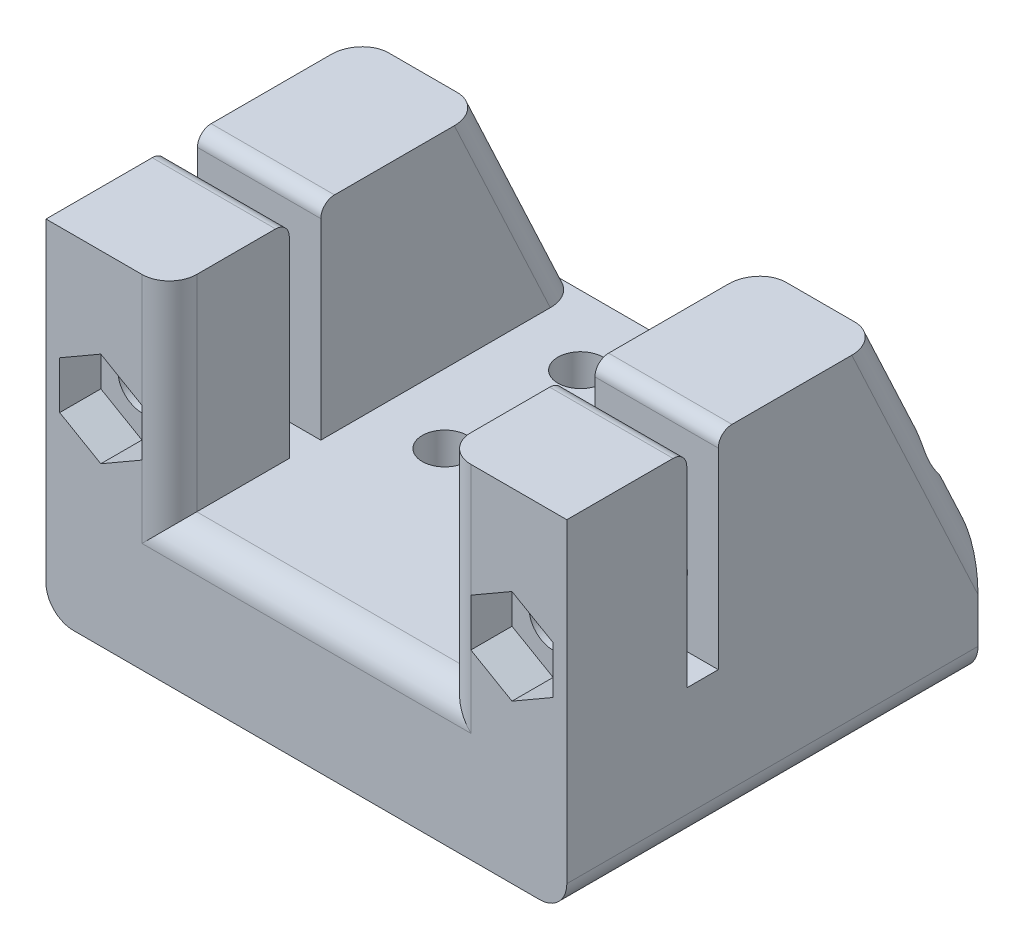
from build123d import *

# Parameters (mm, degrees)
SKETCH_1_W             = 38
SKETCH_1_H             = 30
SKETCH_1_R             = 1.65
EXTRUDE_694_DEPTH      = 25
SKETCH_3_W             = 20
SKETCH_3_H             = 30
CUT_EXTRUDE_926_DEPTH  = 15
SKETCH_4_W             = 2.3
SKETCH_4_H             = 15
CUT_EXTRUDE_1406_DEPTH = 55.488530903
FILLET_3_R             = 1
FILLET_4_R             = 2
SKETCH_6_R             = 1.75
CUT_EXTRUDE_2902_DEPTH = 55.488530903
SKETCH_7_R             = 3.5
CUT_EXTRUDE_3145_DEPTH = 10
CUT_EXTRUDE_3527_DEPTH = 3


with BuildPart() as part:
    # Эскиз1 → Extrude 694 (new body)
    with BuildSketch(Plane(origin=(0, 0, 0), x_dir=(1, 0, 0), z_dir=(0, 1, 0))):
        with Locations((19, 15)):
            Rectangle(SKETCH_1_W, SKETCH_1_H)
        with Locations(Location((14.050252532, 24.949747468, 0), (0, 0, 270))):
            Circle(SKETCH_1_R, mode=Mode.SUBTRACT)
        with Locations(Location((23.949747468, 24.949747468, 0), (0, 0, 270))):
            Circle(SKETCH_1_R, mode=Mode.SUBTRACT)
        with Locations(Location((23.949747468, 15.050252532, 0), (0, 0, 270))):
            Circle(SKETCH_1_R, mode=Mode.SUBTRACT)
        with Locations(Location((14.050252532, 15.050252532, 0), (0, 0, 270))):
            Circle(SKETCH_1_R, mode=Mode.SUBTRACT)
    extrude(amount=EXTRUDE_694_DEPTH)

    # Эскиз3 → Cut-Extrude 926 (cut)
    with BuildSketch(Plane(origin=(0, 25, 0), x_dir=(1, 0, 0), z_dir=(0, 1, 0))):
        with Locations((19, 15)):
            Rectangle(SKETCH_3_W, SKETCH_3_H)
    extrude(amount=-CUT_EXTRUDE_926_DEPTH, mode=Mode.SUBTRACT)

    # Эскиз4 → Cut-Extrude 1406 (cut, through all)
    with BuildSketch(Plane.ZY):
        Polygon((-30, 10), (-23, 25), (-30, 25), align=None)
        with Locations((-9.900252532, 17.5)):
            Rectangle(SKETCH_4_W, SKETCH_4_H)
    extrude(amount=-CUT_EXTRUDE_1406_DEPTH, mode=Mode.SUBTRACT)

    # Скругление3
    fillet_3_edges = [part.edges().sort_by_distance(p)[0] for p in [
        (4.5, 25, -11.050252532),
        (33.5, 25, -11.050252532),
        (4.5, 25, -8.750252532),
        (33.5, 25, -8.750252532),
    ]]
    fillet(fillet_3_edges, radius=FILLET_3_R)

    # Скругление4
    fillet_4_edges = [part.edges().sort_by_distance(p)[0] for p in [
        (9, 17.5, 0),
        (19, 10, 0),
        (29, 17.5, 0),
        (38, 0, -15),
        (0, 0, -15),
        (9, 17.5, -26.5),
        (29, 17.5, -26.5),
        (38, 17.5, -26.5),
        (0, 17.5, -26.5),
    ]]
    fillet(fillet_4_edges, radius=FILLET_4_R)

    # Эскиз6 → Cut-Extrude 2902 (cut, through all)
    with BuildSketch(Plane(origin=(0, 0, -30), x_dir=(-1, 0, 0), z_dir=(0, 0, -1))):
        with Locations((-34, 15)):
            Circle(SKETCH_6_R)
        with Locations((-4, 15)):
            Circle(SKETCH_6_R)
    extrude(amount=-CUT_EXTRUDE_2902_DEPTH, mode=Mode.SUBTRACT)

    # Эскиз7 → Cut-Extrude 3145 (cut)
    with BuildSketch(Plane(origin=(0, 0, -30), x_dir=(-1, 0, 0), z_dir=(0, 0, -1))):
        with Locations((-34, 15)):
            Circle(SKETCH_7_R)
        with Locations((-4, 15)):
            Circle(SKETCH_7_R)
    extrude(amount=-CUT_EXTRUDE_3145_DEPTH, mode=Mode.SUBTRACT)

    # Эскиз8 → Cut-Extrude 3527 (cut)
    with BuildSketch(Plane.XY):
        Polygon((7, 13.267949192), (7, 16.732050808), (4, 18.464101615), (1, 16.732050808), (1, 13.267949192), (4, 11.535898385), align=None)
        Polygon((34, 18.464101615), (31, 16.732050808), (31, 13.267949192), (34, 11.535898385), (37, 13.267949192), (37, 16.732050808), align=None)
    extrude(amount=-CUT_EXTRUDE_3527_DEPTH, mode=Mode.SUBTRACT)


solid = part.part
